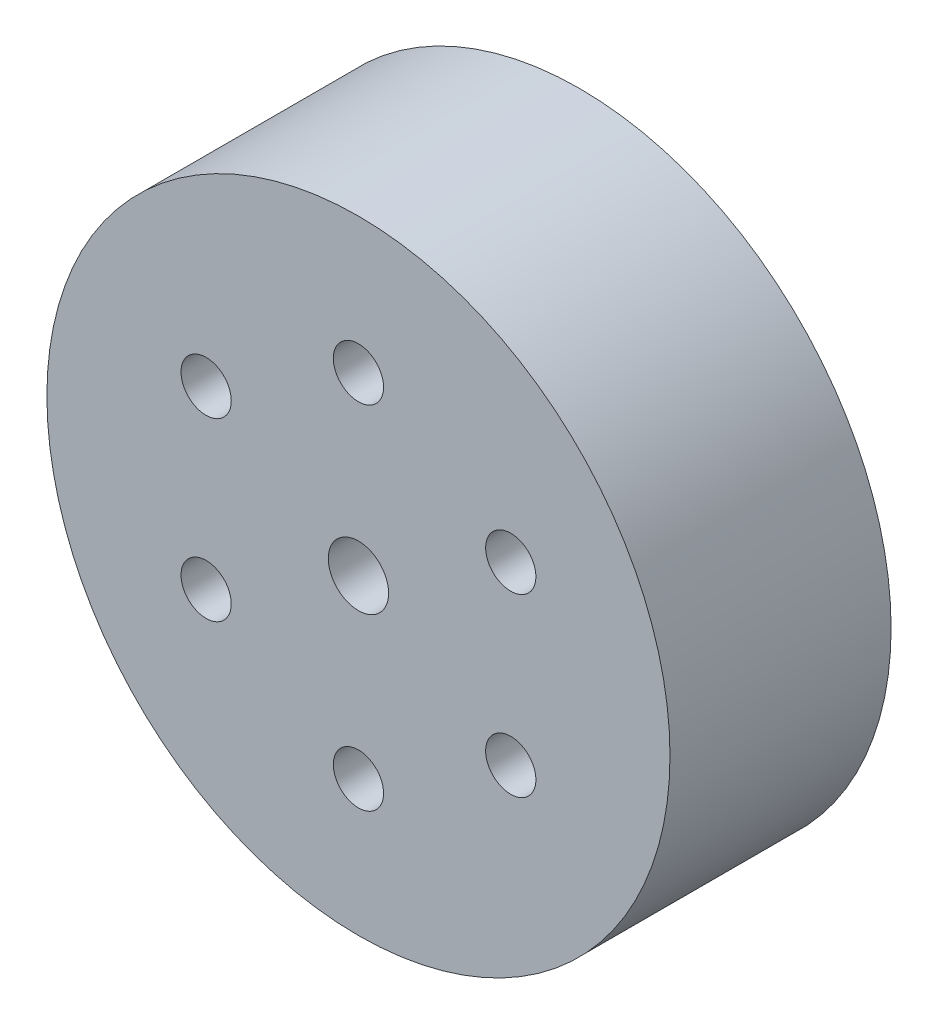
from build123d import *

# Parameters (mm, degrees)
ESQUISSE1_R        = 15.5
ESQUISSE1_R_2      = 1.5
ESQUISSE1_R_3      = 1.25
BOSS_EXTRU_1_DEPTH = 11


with BuildPart() as part:
    # Esquisse1 → Boss.-Extru.1 (new body)
    with BuildSketch(Plane.XY):
        Circle(ESQUISSE1_R)
        Circle(ESQUISSE1_R_2, mode=Mode.SUBTRACT)
        with Locations((0, 8.75)):
            Circle(ESQUISSE1_R_3, mode=Mode.SUBTRACT)
        with Locations((7.577722283, 4.375)):
            Circle(ESQUISSE1_R_3, mode=Mode.SUBTRACT)
        with Locations((7.577722283, -4.375)):
            Circle(ESQUISSE1_R_3, mode=Mode.SUBTRACT)
        with Locations((0, -8.75)):
            Circle(ESQUISSE1_R_3, mode=Mode.SUBTRACT)
        with Locations((-7.577722283, -4.375)):
            Circle(ESQUISSE1_R_3, mode=Mode.SUBTRACT)
        with Locations((-7.577722283, 4.375)):
            Circle(ESQUISSE1_R_3, mode=Mode.SUBTRACT)
    extrude(amount=BOSS_EXTRU_1_DEPTH)


solid = part.part
